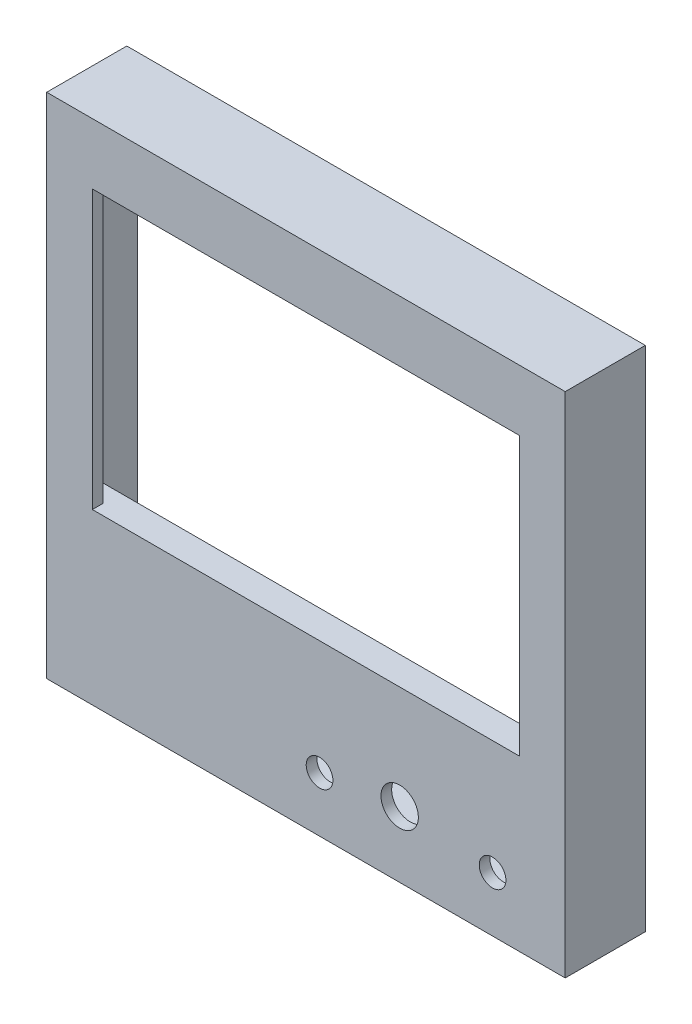
from build123d import *

# Parameters (mm, degrees)
SKETCH1_W                = 80
SKETCH1_H                = 52
BOSS_EXTRUDE1_DEPTH      = 2
SKETCH2_W                = 93.1
SKETCH2_H                = 9.8
BOSS_EXTRUDE2_DEPTH      = 3.3
BOSS_EXTRUDE3_DEPTH      = 13
BOSS_EXTRUDE3_DEPTH_BACK = 2
SKETCH3_W                = 97.1
SKETCH3_H                = 95.1
SKETCH3_W_2              = 93.1
SKETCH3_H_2              = 91.1
SKETCH4_R                = 3.5
CUT_EXTRUDE1_DEPTH       = 29
SKETCH5_R                = 2.5
CUT_EXTRUDE2_DEPTH       = 29


with BuildPart() as part:
    # Sketch1 → Boss-Extrude1 (new body)
    with BuildSketch(Plane.XY):
        Polygon((-46.55, -35.4), (-46.55, -55.7), (46.55, -55.7), (46.55, -35.4), (46.55, 35.4), (-46.55, 35.4), align=None)
        Rectangle(SKETCH1_W, SKETCH1_H, mode=Mode.SUBTRACT)
    extrude(amount=BOSS_EXTRUDE1_DEPTH)

    # Sketch2 → Boss-Extrude2 (add)
    with BuildSketch(Plane(origin=(0, 0, 0), x_dir=(-1, 0, 0), z_dir=(0, 0, -1))):
        with Locations((0, -30.9)):
            Rectangle(SKETCH2_W, SKETCH2_H)
    extrude(amount=BOSS_EXTRUDE2_DEPTH)

    # Sketch3 → Boss-Extrude3 (add, two sides: drawn at the far end of the back side and taken through both)
    with BuildSketch(Plane(origin=(0, 0, 0), x_dir=(-1, 0, 0), z_dir=(0, 0, -1)).offset(-BOSS_EXTRUDE3_DEPTH_BACK)):
        with Locations((0, -10.15)):
            Rectangle(SKETCH3_W, SKETCH3_H)
        with Locations((0, -10.15)):
            Rectangle(SKETCH3_W_2, SKETCH3_H_2, mode=Mode.SUBTRACT)
    extrude(amount=BOSS_EXTRUDE3_DEPTH + BOSS_EXTRUDE3_DEPTH_BACK)

    # Sketch4 → Cut-Extrude1 (cut)
    with BuildSketch(Plane.XY.offset(2)):
        with Locations((17.55, -45.4)):
            Circle(SKETCH4_R)
    extrude(amount=-CUT_EXTRUDE1_DEPTH, mode=Mode.SUBTRACT)

    # Sketch5 → Cut-Extrude2 (cut)
    with BuildSketch(Plane.XY.offset(2)):
        with Locations((2.55, -47.4)):
            Circle(SKETCH5_R)
        with Locations((34.95, -47.4)):
            Circle(SKETCH5_R)
    extrude(amount=-CUT_EXTRUDE2_DEPTH, mode=Mode.SUBTRACT)


solid = part.part
